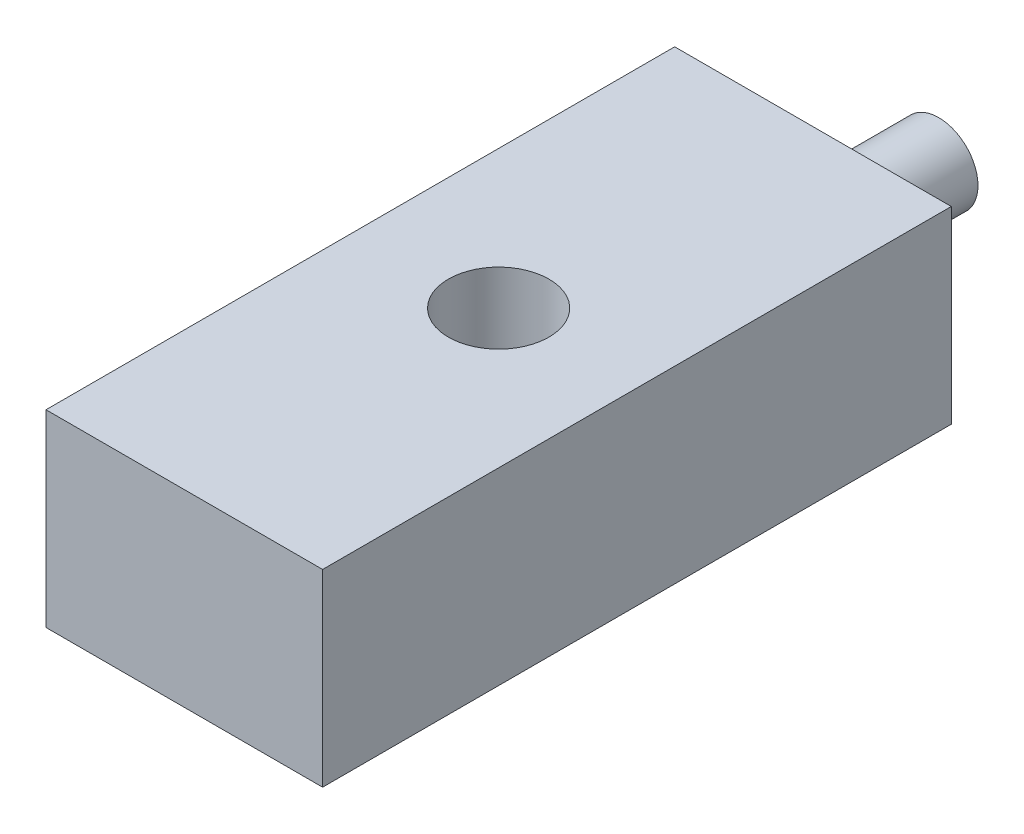
from build123d import *

# Parameters (mm, degrees)
CROQUIS1_R              = 3.125
CROQUIS1_R_2            = 2.7
SALIENTE_EXTRUIR1_DEPTH = 10
CROQUIS2_W              = 22
CROQUIS2_H              = 15
SALIENTE_EXTRUIR2_DEPTH = 50
CROQUIS3_R              = 4
CORTAR_EXTRUIR1_DEPTH   = 63.841873384


with BuildPart() as part:
    # Croquis1 → Saliente-Extruir1 (new body)
    with BuildSketch(Plane.XY):
        with Locations((0.140065102, 8.039289834)):
            Circle(CROQUIS1_R)
        with Locations((0.140065102, 8.039289834)):
            Circle(CROQUIS1_R_2, mode=Mode.SUBTRACT)
    extrude(amount=SALIENTE_EXTRUIR1_DEPTH)

    # Croquis2 → Saliente-Extruir2 (add)
    with BuildSketch(Plane.XY.offset(10)):
        with Locations((0.140065102, 8.039289834)):
            Rectangle(CROQUIS2_W, CROQUIS2_H)
    extrude(amount=SALIENTE_EXTRUIR2_DEPTH)

    # Croquis3 → Cortar-Extruir1 (cut, through all)
    with BuildSketch(Plane.XZ.offset(-0.539289834)):
        with Locations(Location((0.140065102, 35, 0), (0, 0, 270))):
            Circle(CROQUIS3_R)
    extrude(amount=-CORTAR_EXTRUIR1_DEPTH, mode=Mode.SUBTRACT)


solid = part.part
